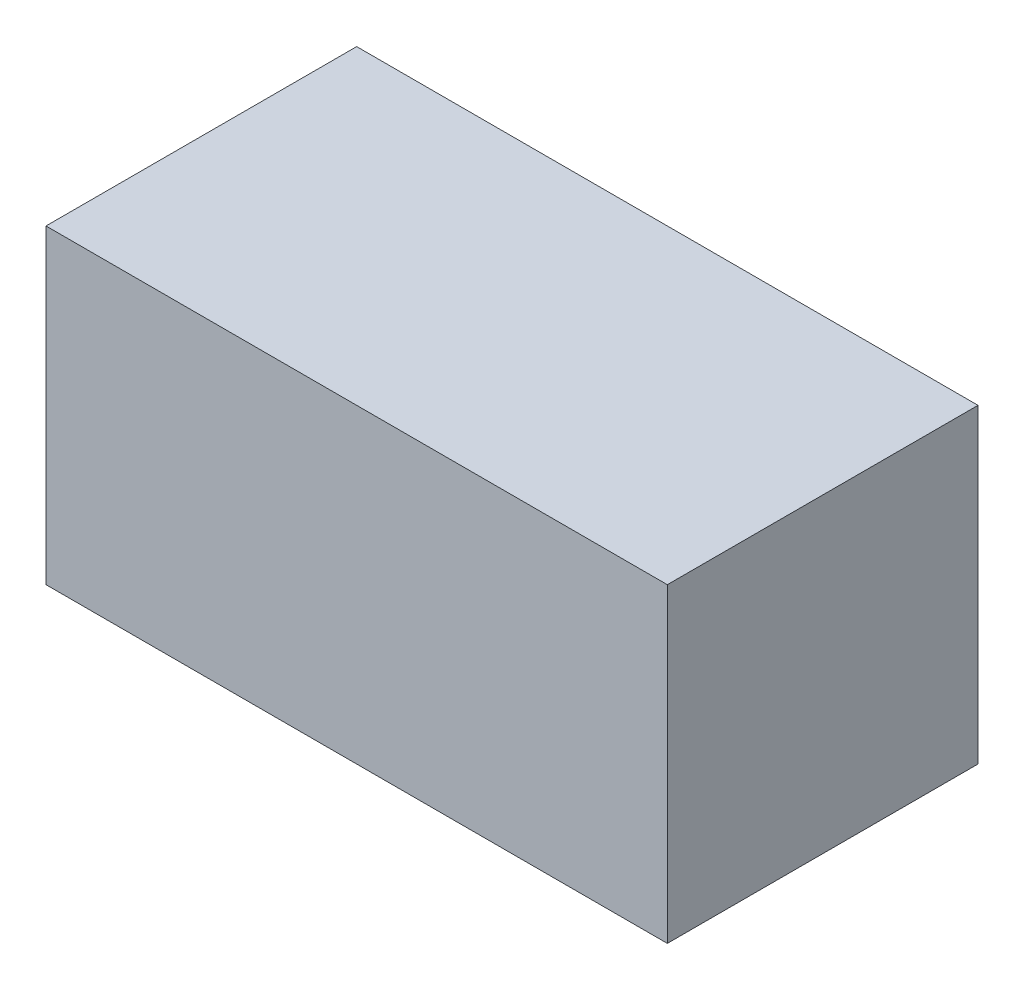
from build123d import *

# Parameters (mm, degrees)
SKETCH1_W           = 39.99992
SKETCH1_H           = 19.99996
BOSS_EXTRUDE1_DEPTH = 19.99996


with BuildPart() as part:
    # Sketch1 → Boss-Extrude1 (new body)
    with BuildSketch(Plane(origin=(0, 0, 0), x_dir=(1, 0, 0), z_dir=(0, 1, 0))):
        Rectangle(SKETCH1_W, SKETCH1_H)
    extrude(amount=BOSS_EXTRUDE1_DEPTH)


solid = part.part
